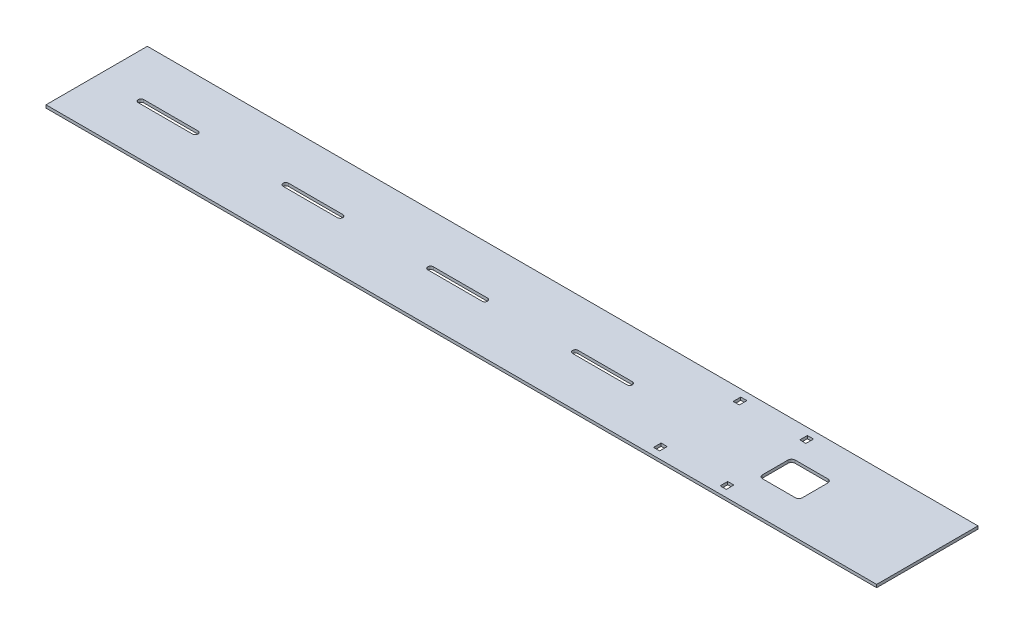
from build123d import *

# Parameters (mm, degrees)
SKETCH_1_W             = 2295
SKETCH_1_H             = 280
EXTRUDE_1_DEPTH        = 8
CUT_EXTRUDE_1_DEPTH    = 8
PATTERN_LINEAR_1_COUNT = 4
PATTERN_LINEAR_1_PITCH = 400
SKETCH_3_W             = 110
SKETCH_3_H             = 90
CUT_EXTRUDE_2_DEPTH    = 8
SKETCH_4_W             = 17
SKETCH_4_H             = 21
CUT_EXTRUDE_3_DEPTH    = 8
FILLET_1_R             = 10


with BuildPart() as part:
    # 草图1 → 凸台-拉伸1 (new body)
    with BuildSketch(Plane(origin=(0, 0, 0), x_dir=(1, 0, 0), z_dir=(0, 1, 0))):
        Rectangle(SKETCH_1_W, SKETCH_1_H)
    extrude(amount=EXTRUDE_1_DEPTH)

    # 草图2 → 切除-拉伸1 (cut)
    with BuildSketch(Plane(origin=(0, 8, 0), x_dir=(1, 0, 0), z_dir=(0, 1, 0))):
        with BuildLine():
            Line((-1025, 7.5), (-875, 7.5))
            ThreePointArc((-875, 7.5), (-867.5, 0), (-875, -7.5))
            Line((-875, -7.5), (-1025, -7.5))
            ThreePointArc((-1025, -7.5), (-1032.5, 0), (-1025, 7.5))
        make_face()
    cut_extrude_1 = extrude(amount=-CUT_EXTRUDE_1_DEPTH, mode=Mode.SUBTRACT)

    # 阵列(线性)1: 切除-拉伸1 ×4
    with Locations(*[(i * PATTERN_LINEAR_1_PITCH, 0, 0) for i in range(1, PATTERN_LINEAR_1_COUNT)]):
        add(cut_extrude_1, mode=Mode.SUBTRACT)

    # 草图3 → 切除-拉伸2 (cut)
    with BuildSketch(Plane(origin=(0, 8, 0), x_dir=(1, 0, 0), z_dir=(0, 1, 0))):
        with Locations((782.5, 0)):
            Rectangle(SKETCH_3_W, SKETCH_3_H)
    extrude(amount=-CUT_EXTRUDE_2_DEPTH, mode=Mode.SUBTRACT)

    # 草图4 → 切除-拉伸3 (cut)
    with BuildSketch(Plane(origin=(0, 8, 0), x_dir=(1, 0, 0), z_dir=(0, 1, 0))):
        with Locations((704, -110)):
            Rectangle(SKETCH_4_W, SKETCH_4_H)
        with Locations((520, -110)):
            Rectangle(SKETCH_4_W, SKETCH_4_H)
        with Locations((520, 110)):
            Rectangle(SKETCH_4_W, SKETCH_4_H)
        with Locations((704, 110)):
            Rectangle(SKETCH_4_W, SKETCH_4_H)
    extrude(amount=-CUT_EXTRUDE_3_DEPTH, mode=Mode.SUBTRACT)

    # 圆角1
    fillet_1_edges = [part.edges().sort_by_distance(p)[0] for p in [
        (837.5, 4, -45),
        (837.5, 4, 45),
        (727.5, 4, 45),
        (727.5, 4, -45),
    ]]
    fillet(fillet_1_edges, radius=FILLET_1_R)


solid = part.part
